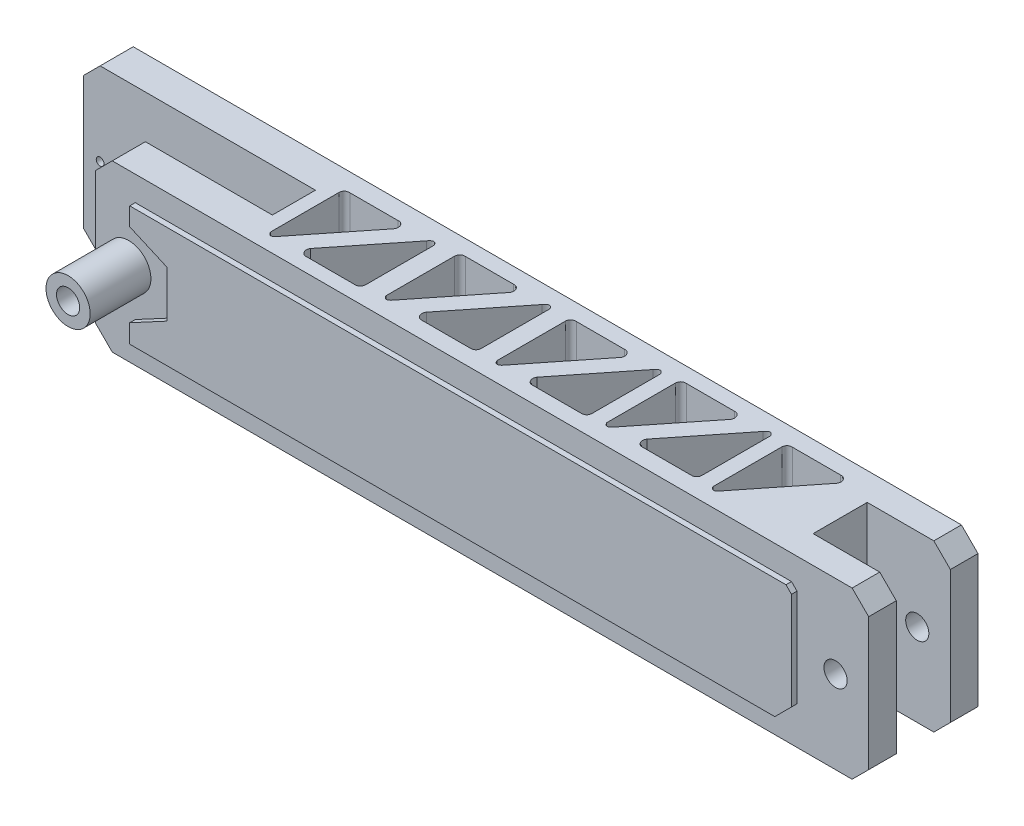
from build123d import *

# Parameters (mm, degrees)
ESQUISSE2_W                  = 140
ESQUISSE2_H                  = 19.8
BOSS_EXTRU_1_DEPTH           = 30
ESQUISSE3_W                  = 26
ESQUISSE3_H                  = 7.8
ENL_V_MAT_EXTRU_1_DEPTH      = 52
ENL_V_MAT_EXTRU_2_DEPTH      = 80
ENL_V_MAT_EXTRU_2_DEPTH_BACK = 97
ESQUISSE4_R                  = 2.1
ESQUISSE6_W                  = 6
ESQUISSE6_H                  = 30
BOSS_EXTRU_2_DEPTH           = 16
ENL_V_MAT_EXTRU_3_DEPTH      = 2.5
ESQUISSE7_R                  = 0.7
ENL_V_MAT_EXTRU_4_DEPTH      = 6
ENL_V_MAT_EXTRU_5_DEPTH      = 40
BOSS_EXTRU_3_START           = 11
ESQUISSE9_R                  = 4
ESQUISSE9_R_2                = 2.1
BOSS_EXTRU_3_DEPTH           = 11
CHANFREIN1_SIZE              = 3
BOSS_EXTRU_4_DEPTH           = 1
BOSS_EXTRU_5_DEPTH           = 1


with BuildPart() as part:
    # Esquisse2 → Boss.-Extru.1 (new body)
    with BuildSketch(Plane(origin=(0, 0, 0), x_dir=(1, 0, 0), z_dir=(0, 1, 0))):
        Rectangle(ESQUISSE2_W, ESQUISSE2_H)
    extrude(amount=BOSS_EXTRU_1_DEPTH)

    # Esquisse3 → Enlèv. mat.-Extru.1 (cut)
    with BuildSketch(Plane(origin=(0, 30, 0), x_dir=(1, 0, 0), z_dir=(0, 1, 0))):
        Polygon((70, 4.9), (54.937588776, 4.9), (54.937588776, 0), (54.937588776, -4.9), (70, -4.9), (70, 0), align=None)
        with Locations((-57, 0)):
            Rectangle(ESQUISSE3_W, ESQUISSE3_H)
    extrude(amount=-ENL_V_MAT_EXTRU_1_DEPTH, mode=Mode.SUBTRACT)

    # Esquisse4 → Enlèv. mat.-Extru.2 (cut, two sides: drawn at the far end of the back side and taken through both)
    with BuildSketch(Plane.XY.offset(9.9).offset(-ENL_V_MAT_EXTRU_2_DEPTH_BACK)):
        with Locations(Location((64, 15, 0), (0, 0, 180))):
            Circle(ESQUISSE4_R)
        with Locations(Location((-64, 15, 0), (0, 0, 180))):
            Circle(ESQUISSE4_R)
    extrude(amount=ENL_V_MAT_EXTRU_2_DEPTH + ENL_V_MAT_EXTRU_2_DEPTH_BACK, mode=Mode.SUBTRACT)

    # Esquisse6 → Boss.-Extru.2 (add)
    with BuildSketch(Plane.ZY.offset(70)):
        with Locations((-6.9, 15)):
            Rectangle(ESQUISSE6_W, ESQUISSE6_H)
    extrude(amount=BOSS_EXTRU_2_DEPTH)

    # Esquisse5 → Enlèv. mat.-Extru.3 (cut)
    with BuildSketch(Plane(origin=(0, 0, -9.9), x_dir=(-1, 0, 0), z_dir=(0, 0, -1))):
        with BuildLine():
            Line((45, 13.442954796), (60.100586175, 11.24997709))
            add(Edge.make_bspline(
                [(60.100586175, 11.24997709), (62.037823533, 9.06697937), (65.961719129, 9.081375624), (67.898871625, 11.249413372)],
                knots=[0, 0, 0, 0, 1, 1, 1, 1], degree=3))
            Line((67.898871625, 11.249413372), (83, 13.357045204))
            add(Edge.make_bspline(
                [(83, 13.357045204), (83.887370859, 13.304277119), (85.318051745, 14.953737135), (83.876527051, 16.61600537), (83, 16.557045204)],
                knots=[0, 0, 0, 0, 0.500032012, 1, 1, 1, 1], degree=3))
            Line((83, 16.557045204), (67.9, 18.749413287))
            add(Edge.make_bspline(
                [(60.1, 18.749413287), (62.04595983, 20.93038148), (65.953953978, 20.931357586), (67.9, 18.749413287)],
                knots=[0, 0, 0, 0, 1, 1, 1, 1], degree=3))
            Line((60.1, 18.749413287), (45, 16.557045204))
            add(Edge.make_bspline(
                [(45, 13.442954796), (44.147634909, 13.386849797), (42.738463075, 15.000132437), (44.147258115, 16.61295974), (45, 16.557045204)],
                knots=[0, 0, 0, 0, 0.499994234, 1, 1, 1, 1], degree=3))
        make_face()
    extrude(amount=-ENL_V_MAT_EXTRU_3_DEPTH, mode=Mode.SUBTRACT)

    # Esquisse7 → Enlèv. mat.-Extru.4 (cut)
    with BuildSketch(Plane(origin=(0, 0, -7.4), x_dir=(-1, 0, 0), z_dir=(0, 0, -1))):
        with Locations((45.001990266, 14.987066484)):
            Circle(ESQUISSE7_R)
        with Locations((83, 14.987066484)):
            Circle(ESQUISSE7_R)
    extrude(amount=-ENL_V_MAT_EXTRU_4_DEPTH, mode=Mode.SUBTRACT)

    # Esquisse8 → Enlèv. mat.-Extru.5 (cut)
    with BuildSketch(Plane(origin=(0, 30, 0), x_dir=(1, 0, 0), z_dir=(0, 1, 0))):
        with BuildLine():
            Line((-41.512313258, 5.70699343), (-41.512313258, -6.747692917))
            add(Edge.make_bspline(
                [(-40.132958184, -6.747692917), (-40.952921119, -7.844487472), (-41.512313258, -6.747692917)],
                knots=[0, 0, 0, 1, 1, 1], degree=2))
            Line((-40.132958184, -6.747692917), (-30.840729383, 4.948581583))
            add(Edge.make_bspline(
                [(-30.840729383, 4.948581583), (-30.339509178, 5.613939181), (-30.897668136, 6.743151149), (-31.775661411, 6.615110323)],
                knots=[0, 0, 0, 0, 1, 1, 1, 1], degree=3))
            Line((-31.775661411, 6.615110323), (-40.455232015, 6.615110323))
            add(Edge.make_bspline(
                [(-40.455232015, 6.615110323), (-41.412067396, 6.636318349), (-41.512313258, 5.70699343)],
                knots=[0, 0, 0, 1, 1, 1], degree=2))
        make_face()
        with BuildLine():
            Line((-24.615833133, -6.434667436), (-24.615833133, 6.020018911))
            add(Edge.make_bspline(
                [(-25.995188207, 6.020018911), (-25.175225271, 7.116813466), (-24.615833133, 6.020018911)],
                knots=[0, 0, 0, 1, 1, 1], degree=2))
            Line((-25.995188207, 6.020018911), (-35.287417008, -5.676255589))
            add(Edge.make_bspline(
                [(-35.287417008, -5.676255589), (-35.788637213, -6.341613187), (-35.230478255, -7.470825155), (-34.35248498, -7.342784329)],
                knots=[0, 0, 0, 0, 1, 1, 1, 1], degree=3))
            Line((-34.35248498, -7.342784329), (-25.672914376, -7.342784329))
            add(Edge.make_bspline(
                [(-25.672914376, -7.342784329), (-24.716078995, -7.363992355), (-24.615833133, -6.434667436)],
                knots=[0, 0, 0, 1, 1, 1], degree=2))
        make_face()
        with BuildLine():
            Line((-21.055208882, 6.185065305), (-21.055208882, -6.269621042))
            add(Edge.make_bspline(
                [(-19.675853809, -6.269621042), (-20.495816744, -7.366415597), (-21.055208882, -6.269621042)],
                knots=[0, 0, 0, 1, 1, 1], degree=2))
            Line((-19.675853809, -6.269621042), (-10.383625008, 5.426653459))
            add(Edge.make_bspline(
                [(-10.383625008, 5.426653459), (-9.882404803, 6.092011056), (-10.440563761, 7.221223025), (-11.318557036, 7.093182198)],
                knots=[0, 0, 0, 0, 1, 1, 1, 1], degree=3))
            Line((-11.318557036, 7.093182198), (-19.99812764, 7.093182198))
            add(Edge.make_bspline(
                [(-19.99812764, 7.093182198), (-20.954963021, 7.114390225), (-21.055208882, 6.185065305)],
                knots=[0, 0, 0, 1, 1, 1], degree=2))
        make_face()
        with BuildLine():
            Line((-4.158728758, -5.95659556), (-4.158728758, 6.498090787))
            add(Edge.make_bspline(
                [(-5.538083832, 6.498090787), (-4.718120896, 7.594885342), (-4.158728758, 6.498090787)],
                knots=[0, 0, 0, 1, 1, 1], degree=2))
            Line((-5.538083832, 6.498090787), (-14.830312633, -5.198183714))
            add(Edge.make_bspline(
                [(-14.830312633, -5.198183714), (-15.331532837, -5.863541311), (-14.773373879, -6.992753279), (-13.895380604, -6.864712453)],
                knots=[0, 0, 0, 0, 1, 1, 1, 1], degree=3))
            Line((-13.895380604, -6.864712453), (-5.21581, -6.864712453))
            add(Edge.make_bspline(
                [(-5.21581, -6.864712453), (-4.25897462, -6.88592048), (-4.158728758, -5.95659556)],
                knots=[0, 0, 0, 1, 1, 1], degree=2))
        make_face()
        with BuildLine():
            Line((-0.824871744, 6.023236985), (-0.824871744, -6.431449362))
            add(Edge.make_bspline(
                [(0.55448333, -6.431449362), (-0.265479606, -7.528243917), (-0.824871744, -6.431449362)],
                knots=[0, 0, 0, 1, 1, 1], degree=2))
            Line((0.55448333, -6.431449362), (9.846712131, 5.264825139))
            add(Edge.make_bspline(
                [(9.846712131, 5.264825139), (10.347932336, 5.930182736), (9.789773377, 7.059394705), (8.911780102, 6.931353878)],
                knots=[0, 0, 0, 0, 1, 1, 1, 1], degree=3))
            Line((8.911780102, 6.931353878), (0.232209498, 6.931353878))
            add(Edge.make_bspline(
                [(0.232209498, 6.931353878), (-0.724625882, 6.952561905), (-0.824871744, 6.023236985)],
                knots=[0, 0, 0, 1, 1, 1], degree=2))
        make_face()
        with BuildLine():
            Line((16.07160838, -6.11842388), (16.07160838, 6.336262467))
            add(Edge.make_bspline(
                [(14.692253307, 6.336262467), (15.512216242, 7.433057022), (16.07160838, 6.336262467)],
                knots=[0, 0, 0, 1, 1, 1], degree=2))
            Line((14.692253307, 6.336262467), (5.400024506, -5.360012034))
            add(Edge.make_bspline(
                [(5.400024506, -5.360012034), (4.898804301, -6.025369631), (5.456963259, -7.154581599), (6.334956534, -7.026540773)],
                knots=[0, 0, 0, 0, 1, 1, 1, 1], degree=3))
            Line((6.334956534, -7.026540773), (15.014527138, -7.026540773))
            add(Edge.make_bspline(
                [(15.014527138, -7.026540773), (15.971362519, -7.0477488), (16.07160838, -6.11842388)],
                knots=[0, 0, 0, 1, 1, 1], degree=2))
        make_face()
        with BuildLine():
            Line((18.844958413, 6.268187688), (18.844958413, -6.186498659))
            add(Edge.make_bspline(
                [(20.224313487, -6.186498659), (19.404350552, -7.283293214), (18.844958413, -6.186498659)],
                knots=[0, 0, 0, 1, 1, 1], degree=2))
            Line((20.224313487, -6.186498659), (29.516542288, 5.509775841))
            add(Edge.make_bspline(
                [(29.516542288, 5.509775841), (30.017762493, 6.175133438), (29.459603535, 7.304345407), (28.58161026, 7.176304581)],
                knots=[0, 0, 0, 0, 1, 1, 1, 1], degree=3))
            Line((28.58161026, 7.176304581), (19.902039656, 7.176304581))
            add(Edge.make_bspline(
                [(19.902039656, 7.176304581), (18.945204275, 7.197512607), (18.844958413, 6.268187688)],
                knots=[0, 0, 0, 1, 1, 1], degree=2))
        make_face()
        with BuildLine():
            Line((35.741438538, -5.873473178), (35.741438538, 6.581213169))
            add(Edge.make_bspline(
                [(34.362083464, 6.581213169), (35.182046399, 7.678007724), (35.741438538, 6.581213169)],
                knots=[0, 0, 0, 1, 1, 1], degree=2))
            Line((34.362083464, 6.581213169), (25.069854663, -5.115061331))
            add(Edge.make_bspline(
                [(25.069854663, -5.115061331), (24.568634458, -5.780418929), (25.126793416, -6.909630897), (26.004786691, -6.781590071)],
                knots=[0, 0, 0, 0, 1, 1, 1, 1], degree=3))
            Line((26.004786691, -6.781590071), (34.684357295, -6.781590071))
            add(Edge.make_bspline(
                [(34.684357295, -6.781590071), (35.641192676, -6.802798097), (35.741438538, -5.873473178)],
                knots=[0, 0, 0, 1, 1, 1], degree=2))
        make_face()
        with BuildLine():
            Line((38.49632739, 5.874742843), (38.49632739, -6.579943504))
            add(Edge.make_bspline(
                [(39.875682464, -6.579943504), (39.055719529, -7.676738059), (38.49632739, -6.579943504)],
                knots=[0, 0, 0, 1, 1, 1], degree=2))
            Line((39.875682464, -6.579943504), (49.167911265, 5.116330996))
            add(Edge.make_bspline(
                [(49.167911265, 5.116330996), (49.66913147, 5.781688594), (49.110972512, 6.910900562), (48.232979237, 6.782859736)],
                knots=[0, 0, 0, 0, 1, 1, 1, 1], degree=3))
            Line((48.232979237, 6.782859736), (39.553408633, 6.782859736))
            add(Edge.make_bspline(
                [(39.553408633, 6.782859736), (38.596573252, 6.804067762), (38.49632739, 5.874742843)],
                knots=[0, 0, 0, 1, 1, 1], degree=2))
        make_face()
    extrude(amount=-ENL_V_MAT_EXTRU_5_DEPTH, mode=Mode.SUBTRACT)

    # Esquisse9 → Boss.-Extru.3 (add)
    with BuildSketch(Plane.XY.offset(9.9).offset(BOSS_EXTRU_3_START)):
        with Locations(Location((-64, 15, 0), (0, 0, 180))):
            Circle(ESQUISSE9_R)
        with Locations((-64, 15)):
            Circle(ESQUISSE9_R_2, mode=Mode.SUBTRACT)
    extrude(amount=-BOSS_EXTRU_3_DEPTH)

    # Chanfrein1
    chanfrein1_edges = [part.edges().sort_by_distance(p)[0] for p in [
        (70, 30, 7.4),
        (-70, 0, 6.9),
        (70, 0, -7.4),
        (-70, 30, 6.9),
        (70, 30, -7.4),
        (70, 0, 7.4),
        (-86, 0, -6.9),
        (-86, 30, -6.9),
    ]]
    chamfer(chanfrein1_edges, length=CHANFREIN1_SIZE)

    # Esquisse10 → Boss.-Extru.4 (add)
    with BuildSketch(Plane(origin=(0, 0, -9.9), x_dir=(-1, 0, 0), z_dir=(0, 0, -1))):
        Polygon((37.221470424, 6.446505443), (34.578623316, 3.803658335), (-55.995917135, 3.803658335), (-57.943032821, 5.750774022), (-57.943032821, 24.151602184), (-54.388265516, 27.706369489), (34.363797978, 26.704920409), (37.221470424, 23.94484481), align=None)
    extrude(amount=BOSS_EXTRU_4_DEPTH)

    # Esquisse11 → Boss.-Extru.5 (add)
    with BuildSketch(Plane.XY.offset(9.9)):
        Polygon((-62.835758046, 25.522347334), (56.02268563, 25.522347334), (57.022429753, 24.522603211), (57.022429753, 6.850275425), (53.994527078, 3.82237275), (-62.835758046, 3.82237275), (-62.835758046, 7.19244456), (-56.095614425, 10.809106991), (-56.095614425, 19.275384954), (-62.835758046, 22.234472397), align=None)
    extrude(amount=BOSS_EXTRU_5_DEPTH)


solid = part.part
